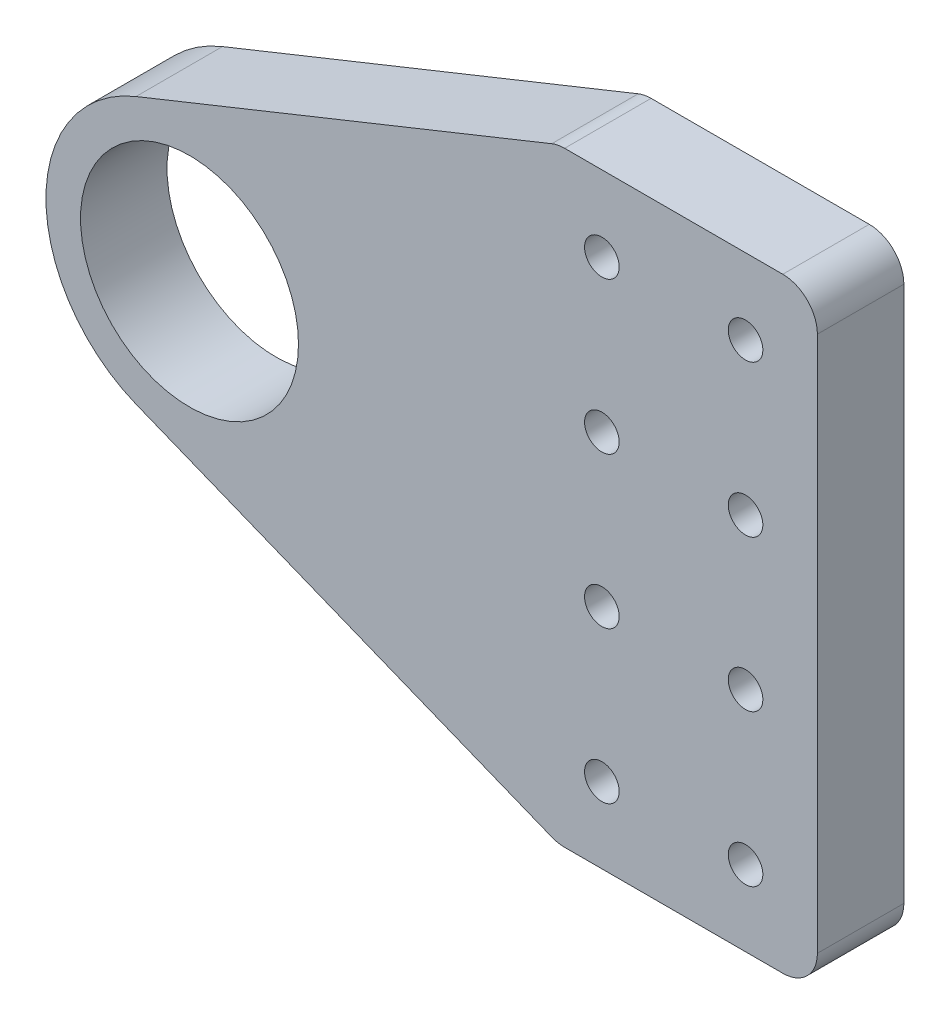
from build123d import *

# Parameters (mm, degrees)
SKETCH1_R           = 16.002
SKETCH1_R_2         = 2.54
BOSS_EXTRUDE1_DEPTH = 12.7


with BuildPart() as part:
    # Sketch1 → Boss-Extrude1 (new body)
    with BuildSketch(Plane.XY):
        with BuildLine():
            Line((877.282099838, -292.1), (909.32, -292.1))
            ThreePointArc((909.32, -292.1), (912.912102448, -290.612102448), (914.4, -287.02))
            Line((914.4, -287.02), (914.4, -208.28))
            ThreePointArc((914.4, -208.28), (912.912102448, -204.687897552), (909.32, -203.2))
            Line((909.32, -203.2), (877.282099838, -203.2))
            ThreePointArc((877.282099838, -203.2), (876.317854156, -203.292352231), (875.388667624, -203.566051077))
            Line((875.388667624, -203.566051077), (814.340256312, -228.087111968))
            ThreePointArc((814.340256312, -228.087111968), (801.116, -247.65), (814.340256312, -267.212888032))
            Line((814.340256312, -267.212888032), (875.388667624, -291.733948923))
            ThreePointArc((875.388667624, -291.733948923), (876.317854156, -292.007647769), (877.282099838, -292.1))
        make_face()
        with Locations((822.198, -247.65)):
            Circle(SKETCH1_R, mode=Mode.SUBTRACT)
        with Locations((903.850524959, -214.298026916)):
            Circle(SKETCH1_R_2, mode=Mode.SUBTRACT)
        with Locations(Location((882.751574878, -214.298026916, 0), (0, 0, 180))):
            Circle(SKETCH1_R_2, mode=Mode.SUBTRACT)
        with Locations((882.751574878, -236.551973084)):
            Circle(SKETCH1_R_2, mode=Mode.SUBTRACT)
        with Locations(Location((903.850524959, -236.551973084, 0), (0, 0, 180))):
            Circle(SKETCH1_R_2, mode=Mode.SUBTRACT)
        with Locations(Location((882.751574878, -258.748026916, 0), (0, 0, 180))):
            Circle(SKETCH1_R_2, mode=Mode.SUBTRACT)
        with Locations((882.751574878, -281.001973084)):
            Circle(SKETCH1_R_2, mode=Mode.SUBTRACT)
        with Locations((903.850524959, -258.748026916)):
            Circle(SKETCH1_R_2, mode=Mode.SUBTRACT)
        with Locations(Location((903.850524959, -281.001973084, 0), (0, 0, 180))):
            Circle(SKETCH1_R_2, mode=Mode.SUBTRACT)
    extrude(amount=BOSS_EXTRUDE1_DEPTH)


solid = part.part
